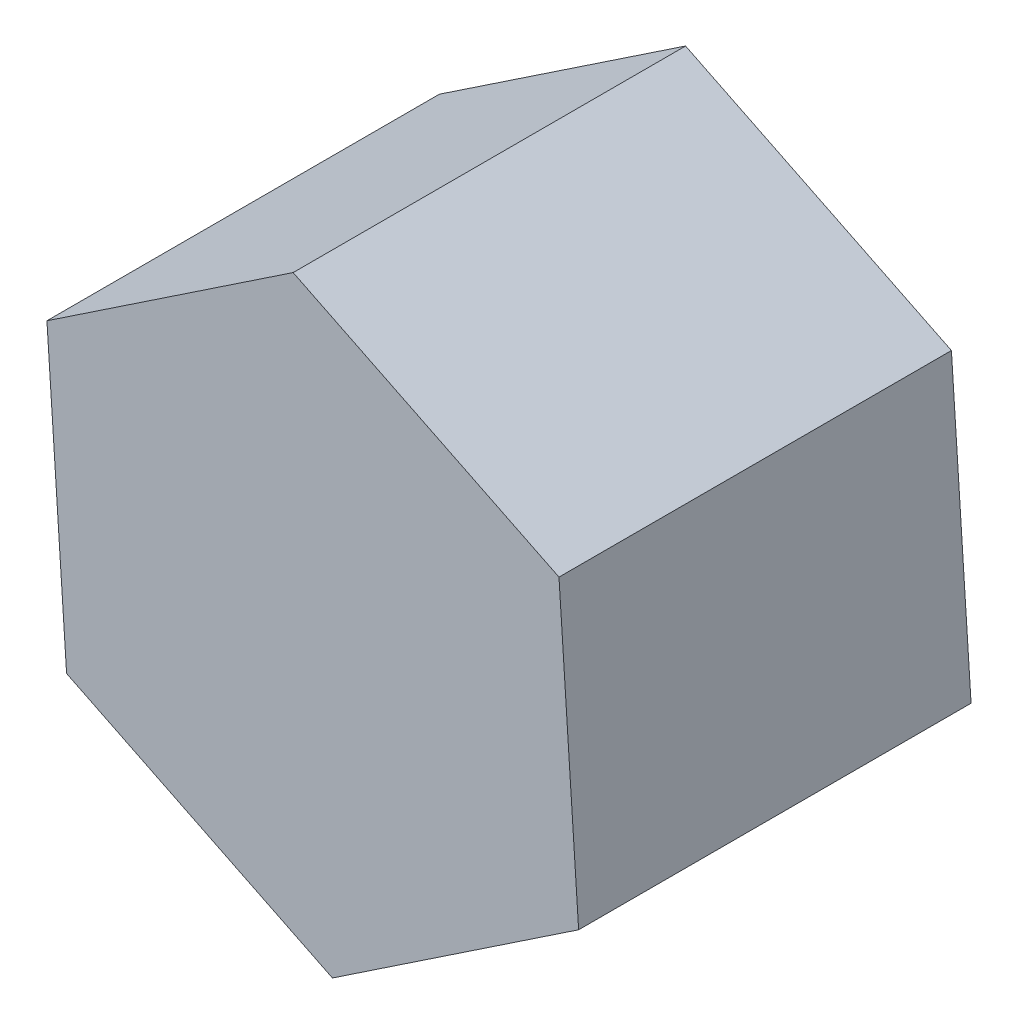
from build123d import *

# Parameters (mm, degrees)
BOSS_EXTRUDE1_DEPTH = 50


with BuildPart() as part:
    # Sketch1 → Boss-Extrude1 (new body)
    with BuildSketch(Plane.XY):
        Polygon((33.872312052, -16.66517753), (31.368623125, 21.001693957), (-2.503688927, 37.666871487), (-33.872312052, 16.66517753), (-31.368623125, -21.001693957), (2.503688927, -37.666871487), align=None)
    extrude(amount=BOSS_EXTRUDE1_DEPTH)


solid = part.part
